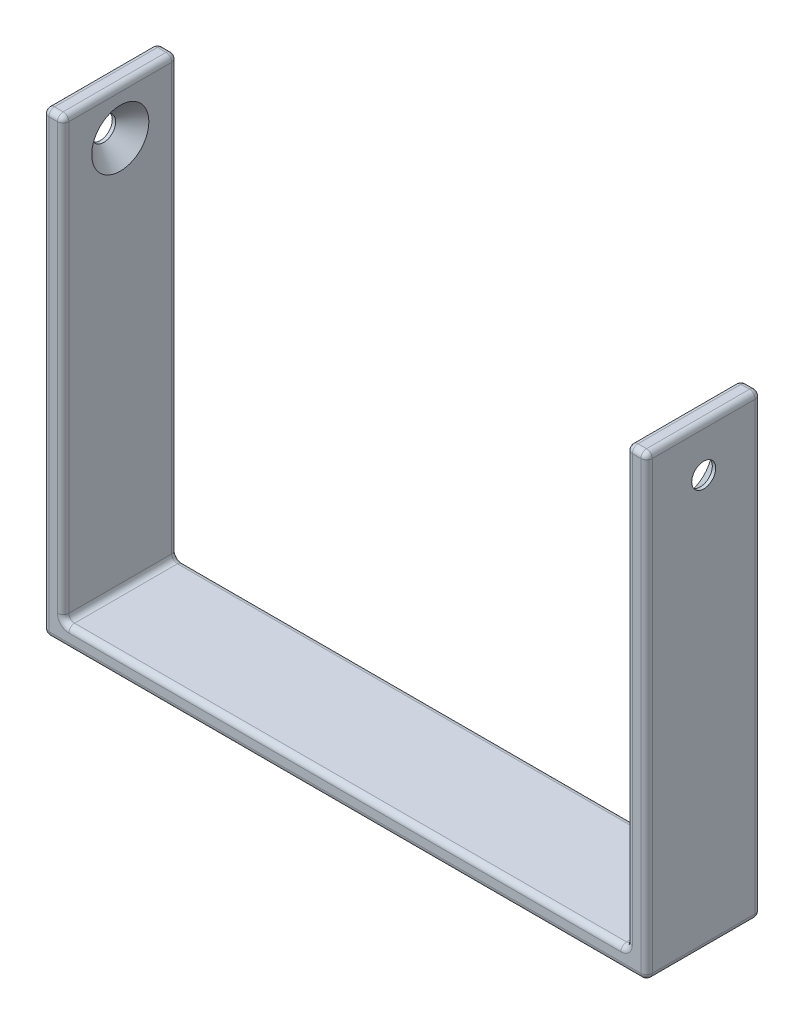
from build123d import *

# Parameters (mm, degrees)
SKETCH1_W           = 20
SKETCH1_H           = 80
BOSS_EXTRUDE1_DEPTH = 105.6
CUT_EXTRUDE1_REACH  = 135.983
SKETCH2_W           = 98.6
SKETCH2_H           = 76.5
FILLET1_R           = 1


with BuildPart() as part:
    # Sketch1 → Boss-Extrude1 (new body)
    with BuildSketch(Plane(origin=(0, 0, 0), x_dir=(0, 0, -1), z_dir=(1, 0, 0))):
        with Locations((0, 40)):
            Rectangle(SKETCH1_W, SKETCH1_H)
    extrude(amount=-BOSS_EXTRUDE1_DEPTH)

    # Sketch2 → Cut-Extrude1 (cut, up to next)
    with BuildSketch(Plane(origin=(0, 0, -10), x_dir=(-1, 0, 0), z_dir=(0, 0, -1)), mode=Mode.PRIVATE) as cut_extrude1_sk1:
        with Locations((52.8, 41.75)):
            Rectangle(SKETCH2_W, SKETCH2_H)
    cut_extrude1_tool1 = extrude(cut_extrude1_sk1.sketch, amount=-CUT_EXTRUDE1_REACH, mode=Mode.PRIVATE) & part.part
    add(cut_extrude1_tool1.solids().sort_by_distance((-52.8, 41.75, -10))[0], mode=Mode.SUBTRACT)

    # Sketch4 → M5 Tapped Hole2 (revolve, cut)
    with BuildSketch(Plane(origin=(-102.1, 72, 0), x_dir=(0, 0, -1), z_dir=(0, 1, 0))):
        Polygon((0, 0), (0, 3.5), (2.1, 3.5), (2.1, 2.9), (5, 0), align=None)
    revolve(axis=Axis((-95.75, 72, 0), (-1, 0, 0)), mode=Mode.SUBTRACT)

    # Sketch15 → M5 Tapped Hole1 (revolve, cut)
    with BuildSketch(Plane(origin=(-3.5, 72, 0), x_dir=(0, 0, 1), z_dir=(0, 1, 0))):
        Polygon((0, 0), (0, 3.5), (2.1, 3.5), (2.1, 2.9), (5, 0), align=None)
    revolve(axis=Axis((-9.85, 72, 0), (1, 0, 0)), mode=Mode.SUBTRACT)

    # Fillet1
    fillet1_edges = [part.edges().sort_by_distance(p)[0] for p in [
        (-105.6, 40, -10),
        (-105.6, 80, 0),
        (-1.75, 80, -10),
        (-1.75, 80, 10),
        (-3.5, 41.75, 10),
        (-3.5, 3.5, 0),
        (-3.5, 80, 0),
        (-102.1, 41.75, 10),
        (-102.1, 80, 0),
        (-52.8, 3.5, 10),
        (-102.1, 3.5, 0),
        (-3.5, 41.75, -10),
        (-52.8, 3.5, -10),
        (-102.1, 41.75, -10),
        (-105.6, 40, 10),
        (0, 80, 0),
        (0, 40, -10),
        (0, 0, 0),
        (0, 40, 10),
        (-105.6, 0, 0),
        (-103.85, 80, 10),
        (-103.85, 80, -10),
        (-52.8, 0, -10),
        (-52.8, 0, 10),
    ]]
    fillet(fillet1_edges, radius=FILLET1_R)


solid = part.part
